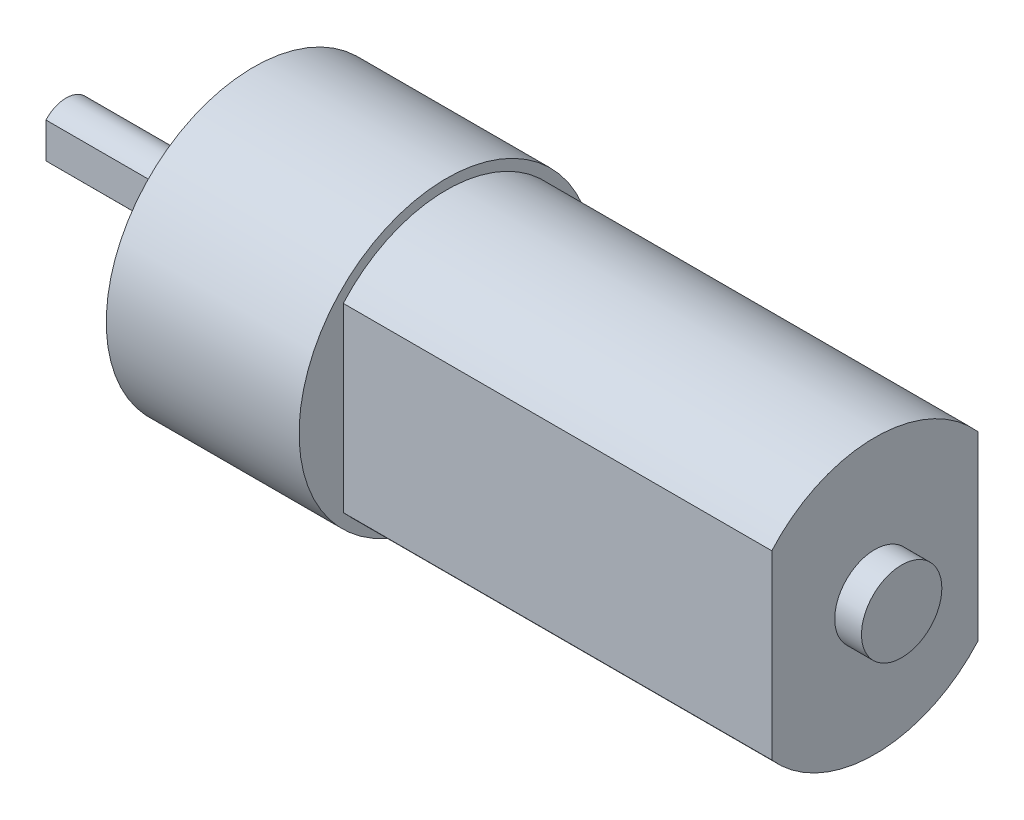
from build123d import *

# Parameters (mm, degrees)
ESQUISSE2_W             = 8.320302529
ESQUISSE2_H             = 23.371875391
ESQUISSE2_W_2           = 7.922092332
ENL_V_MAT_EXTRU_1_DEPTH = 32
ENL_V_START             = -2
ENL_V_MAT_EXTRU_2_DEPTH = 2
ESQUISSE4_R             = 1
ENL_V_MAT_EXTRU_3_DEPTH = 4
ESQUISSE5_W             = 12.730996015
ESQUISSE5_H             = 15.162705394
ENL_V_MAT_EXTRU_4_DEPTH = 8


with BuildPart() as part:
    # Esquisse1 → Révolution1 (revolve)
    with BuildSketch(Plane.XY, mode=Mode.PRIVATE) as r_volution1_sk:
        Polygon((-14, 0), (-14, -2), (-3, -2), (-3, -4), (-2, -4), (-2, -7), (0, -7), (0, -11), (14.4, -11), (14.4, -10.25), (46.4, -10.25), (46.4, -3), (48.4, -3), (48.4, 0), align=None)
    revolve(r_volution1_sk.sketch.rotate(Axis((38.703399471, 0, 0), (-1, 0, 0)), 270), axis=Axis((38.703399471, 0, 0), (-1, 0, 0)))

    # Esquisse2 → Enlèv. mat.-Extru.1 (cut)
    with BuildSketch(Plane(origin=(46.4, 0, 0), x_dir=(0, 0, -1), z_dir=(1, 0, 0))):
        with Locations((-11.860151265, -0.490104857)):
            Rectangle(ESQUISSE2_W, ESQUISSE2_H)
        with Locations((11.661046166, -0.490104857)):
            Rectangle(ESQUISSE2_W_2, ESQUISSE2_H)
    extrude(amount=-ENL_V_MAT_EXTRU_1_DEPTH, mode=Mode.SUBTRACT)

    # Esquisse3 → Enlèv. mat.-Extru.2 (cut)
    with BuildSketch(Plane.ZY.offset(2).offset(ENL_V_START)):
        with BuildLine():
            Line((6.792150444, 1.69313093), (1.69313093, 6.792150444))
            ThreePointArc((1.69313093, 6.792150444), (4.949747468, 4.949747468), (6.792150444, 1.69313093))
        make_face()
        with BuildLine():
            Line((-6.792150444, -1.69313093), (-1.69313093, -6.792150444))
            ThreePointArc((-1.69313093, -6.792150444), (-4.949747468, -4.949747468), (-6.792150444, -1.69313093))
        make_face()
    extrude(amount=ENL_V_MAT_EXTRU_2_DEPTH, mode=Mode.SUBTRACT)

    # Esquisse4 → Enlèv. mat.-Extru.3 (cut)
    with BuildSketch(Plane.ZY):
        with Locations((0, 9)):
            Circle(ESQUISSE4_R)
        with Locations((-9, 0)):
            Circle(ESQUISSE4_R)
        with Locations((0, -9)):
            Circle(ESQUISSE4_R)
        with Locations((9, 0)):
            Circle(ESQUISSE4_R)
    extrude(amount=-ENL_V_MAT_EXTRU_3_DEPTH, mode=Mode.SUBTRACT)

    # Esquisse5 → Enlèv. mat.-Extru.4 (cut)
    with BuildSketch(Plane.ZY.offset(14)):
        with Locations((7.865498008, 1.780904513)):
            Rectangle(ESQUISSE5_W, ESQUISSE5_H)
    extrude(amount=-ENL_V_MAT_EXTRU_4_DEPTH, mode=Mode.SUBTRACT)


solid = part.part
